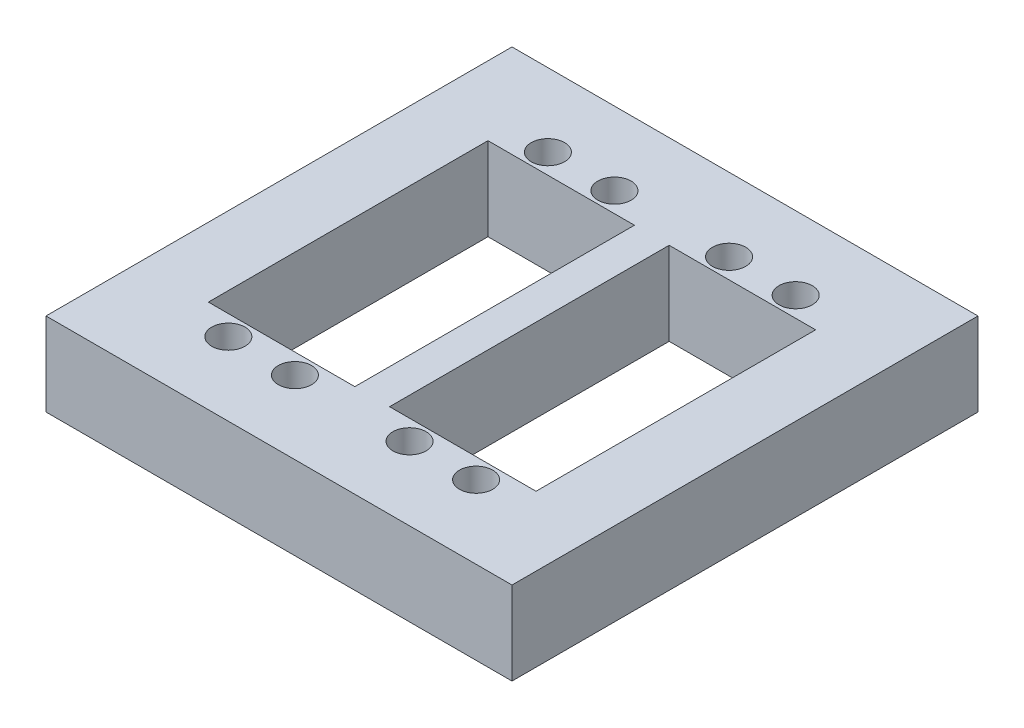
from build123d import *

# Parameters (mm, degrees)
SKETCH1_W           = 70
SKETCH1_H           = 70
SKETCH1_R           = 2.5
SKETCH1_W_2         = 22
SKETCH1_H_2         = 42
BOSS_EXTRUDE1_DEPTH = 12.5


with BuildPart() as part:
    # Sketch1 → Boss-Extrude1 (new body)
    with BuildSketch(Plane(origin=(0, 0, 0), x_dir=(1, 0, 0), z_dir=(0, 1, 0))):
        Rectangle(SKETCH1_W, SKETCH1_H)
        with Locations(Location((-18.608500965, 24, 0), (0, 0, 270))):
            Circle(SKETCH1_R, mode=Mode.SUBTRACT)
        with Locations(Location((-8.608500965, 24, 0), (0, 0, 270))):
            Circle(SKETCH1_R, mode=Mode.SUBTRACT)
        with Locations(Location((-8.608500965, -24, 0), (0, 0, 90))):
            Circle(SKETCH1_R, mode=Mode.SUBTRACT)
        with Locations(Location((-18.608500965, -24, 0), (0, 0, 90))):
            Circle(SKETCH1_R, mode=Mode.SUBTRACT)
        with Locations(Location((8.608500965, -24, 0), (0, 0, 270))):
            Circle(SKETCH1_R, mode=Mode.SUBTRACT)
        with Locations(Location((18.608500965, -24, 0), (0, 0, 270))):
            Circle(SKETCH1_R, mode=Mode.SUBTRACT)
        with Locations(Location((8.608500965, 24, 0), (0, 0, 90))):
            Circle(SKETCH1_R, mode=Mode.SUBTRACT)
        with Locations(Location((18.608500965, 24, 0), (0, 0, 90))):
            Circle(SKETCH1_R, mode=Mode.SUBTRACT)
        with Locations((-13.608500965, 0)):
            Rectangle(SKETCH1_W_2, SKETCH1_H_2, mode=Mode.SUBTRACT)
        with Locations((13.608500965, 0)):
            Rectangle(SKETCH1_W_2, SKETCH1_H_2, mode=Mode.SUBTRACT)
    extrude(amount=BOSS_EXTRUDE1_DEPTH)


solid = part.part
